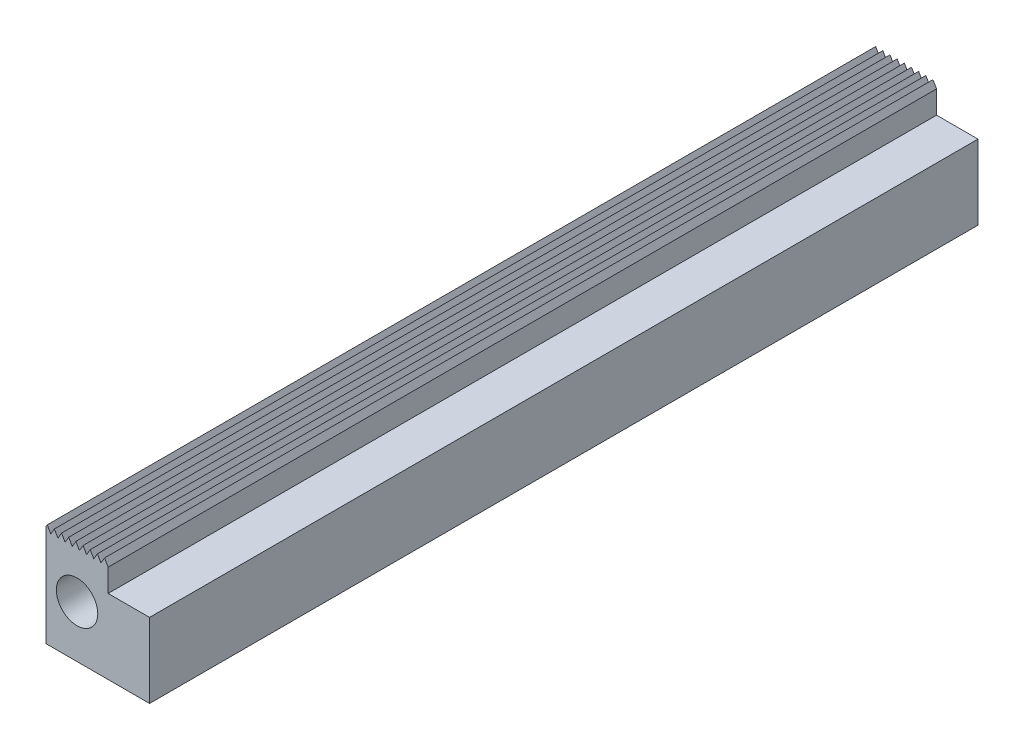
from build123d import *

# Parameters (mm, degrees)
SKETCH1_R           = 5
BOSS_EXTRUDE1_DEPTH = 200
SKETCH2_R           = 2.5
CUT_EXTRUDE1_DEPTH  = 6


with BuildPart() as part:
    # Sketch1 → Boss-Extrude1 (new body)
    with BuildSketch(Plane.XY):
        Polygon((-12.5, 11.990821063), (-12.5, -12.5), (12.5, -12.5), (12.5, 5.5), (2.5, 5.5), (2.5, 11), (2.498974596, 11.001776051), (1.633974596, 12.5), (0.768974596, 11.001776051), (-0.096025404, 12.5), (-0.961025404, 11.001776051), (-1.826025404, 12.5), (-2.691025404, 11.001776051), (-3.556025404, 12.5), (-4.421025404, 11.001776051), (-5.286025404, 12.5), (-6.151025404, 11.001776051), (-7.016025404, 12.5), (-7.881025404, 11.001776051), (-8.746025404, 12.5), (-9.611025404, 11.001776051), (-10.476025404, 12.5), (-11.341025404, 11.001776051), (-12.206025404, 12.5), align=None)
        with Locations((-5, 0)):
            Circle(SKETCH1_R, mode=Mode.SUBTRACT)
    extrude(amount=BOSS_EXTRUDE1_DEPTH)

    # Sketch2 → Cut-Extrude1 (cut)
    with BuildSketch(Plane.XZ.offset(12.5)):
        with Locations(Location((0, 140, 0), (0, 0, 270))):
            Circle(SKETCH2_R)
        with Locations(Location((0, 60, 0), (0, 0, 90))):
            Circle(SKETCH2_R)
    extrude(amount=-CUT_EXTRUDE1_DEPTH, mode=Mode.SUBTRACT)


solid = part.part
